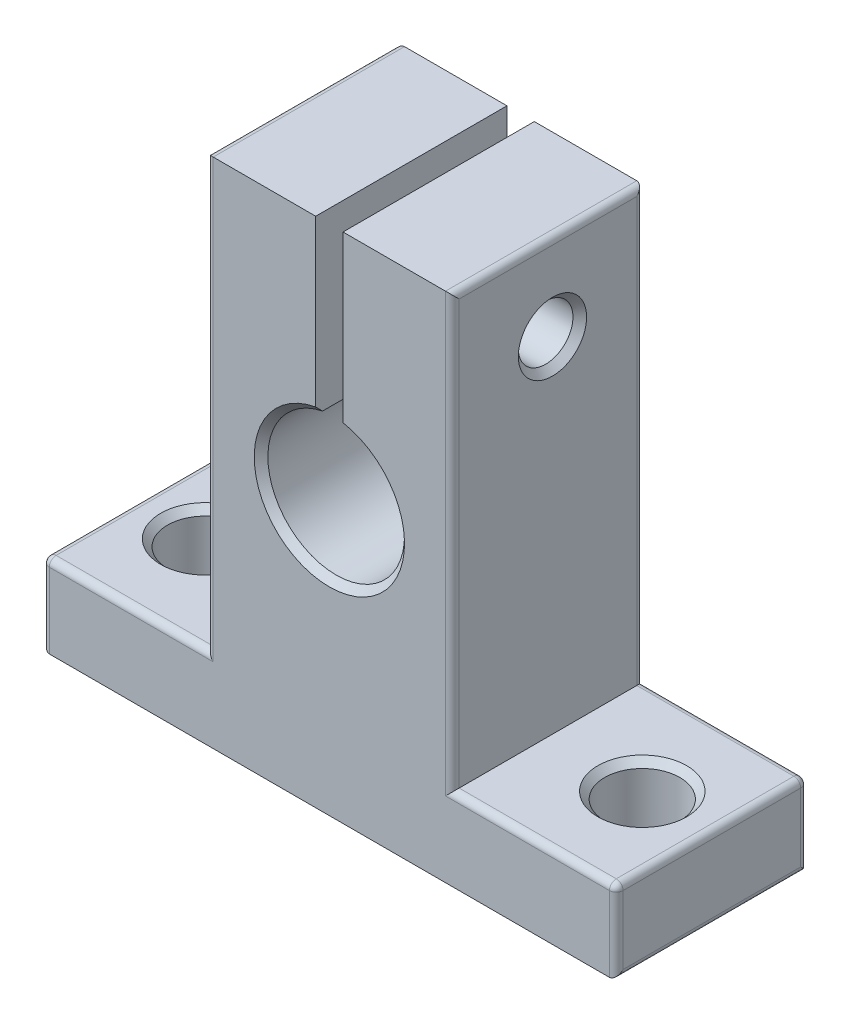
from build123d import *

# Parameters (mm, degrees)
BOSS_EXTRUDE1_DEPTH     = 7
SKETCH2_R               = 2.75
CUT_EXTRUDE1_DEPTH      = 39.5
CUT_EXTRUDE2_DEPTH      = 42.512046444
CUT_EXTRUDE2_DEPTH_BACK = 42.512046444
SKETCH5_R               = 2
CHAMFER2_SIZE           = 0.5
FILLET2_R               = 0.5


with BuildPart() as part:
    # Sketch1 → Boss-Extrude1 (new, symmetric)
    with BuildSketch(Plane.XY):
        with BuildLine():
            Line((-21, -3), (-21, 3))
            Line((-21, 3), (-9, 3))
            Line((-9, 3), (-9, 34.5))
            Line((-9, 34.5), (-1, 34.5))
            Line((-1, 34.5), (-1, 21.898979486))
            ThreePointArc((-1, 21.898979486), (0, 12), (1, 21.898979486))
            Line((1, 21.898979486), (1, 34.5))
            Line((1, 34.5), (9, 34.5))
            Line((9, 34.5), (9, 3))
            Line((9, 3), (21, 3))
            Line((21, 3), (21, -3))
            Line((21, -3), (-21, -3))
        make_face()
    extrude(amount=BOSS_EXTRUDE1_DEPTH, both=True)

    # Sketch2 → Cut-Extrude1 (cut, through all)
    with BuildSketch(Plane(origin=(0, 3, 0), x_dir=(1, 0, 0), z_dir=(0, 1, 0))):
        with Locations(Location((15.904501915, 0, 0), (0, 0, 180))):
            Circle(SKETCH2_R)
        with Locations((-16.095498085, 0)):
            Circle(SKETCH2_R)
    extrude(amount=-CUT_EXTRUDE1_DEPTH, mode=Mode.SUBTRACT)

    # Sketch5 → Cut-Extrude2 (cut, two sides: drawn at the far end of the back side and taken through both)
    with BuildSketch(Plane(origin=(-1, 0, 0), x_dir=(0, 0, -1), z_dir=(1, 0, 0)).offset(-CUT_EXTRUDE2_DEPTH_BACK)):
        with Locations((0.330734984, 28.199489743)):
            Circle(SKETCH5_R)
    extrude(amount=CUT_EXTRUDE2_DEPTH + CUT_EXTRUDE2_DEPTH_BACK, mode=Mode.SUBTRACT)

    # Chamfer2
    chamfer2_edges = [part.edges().sort_by_distance(p)[0] for p in [
        (0, 12, -7),
        (0, 12, 7),
        (18.654501915, 3, 0),
        (-18.845498085, 3, 0),
        (-9, 28.199489743, 1.669265016),
        (9, 28.199489743, 1.669265016),
    ]]
    chamfer(chamfer2_edges, length=CHAMFER2_SIZE)

    # Fillet2
    fillet2_edges = [part.edges().sort_by_distance(p)[0] for p in [
        (-15, 3, 7),
        (9, 18.75, -7),
        (15, 3, -7),
        (-21, 0, 7),
        (21, 0, -7),
        (-21, 0, -7),
        (-15, 3, -7),
        (-9, 18.75, -7),
        (21, 0, 7),
        (9, 34.5, 0),
        (21, 3, 0),
        (21, -3, 0),
        (-21, -3, 0),
        (-21, 3, 0),
        (-9, 34.5, 0),
        (15, 3, 7),
        (9, 18.75, 7),
        (-9, 18.75, 7),
    ]]
    fillet(fillet2_edges, radius=FILLET2_R)


solid = part.part
